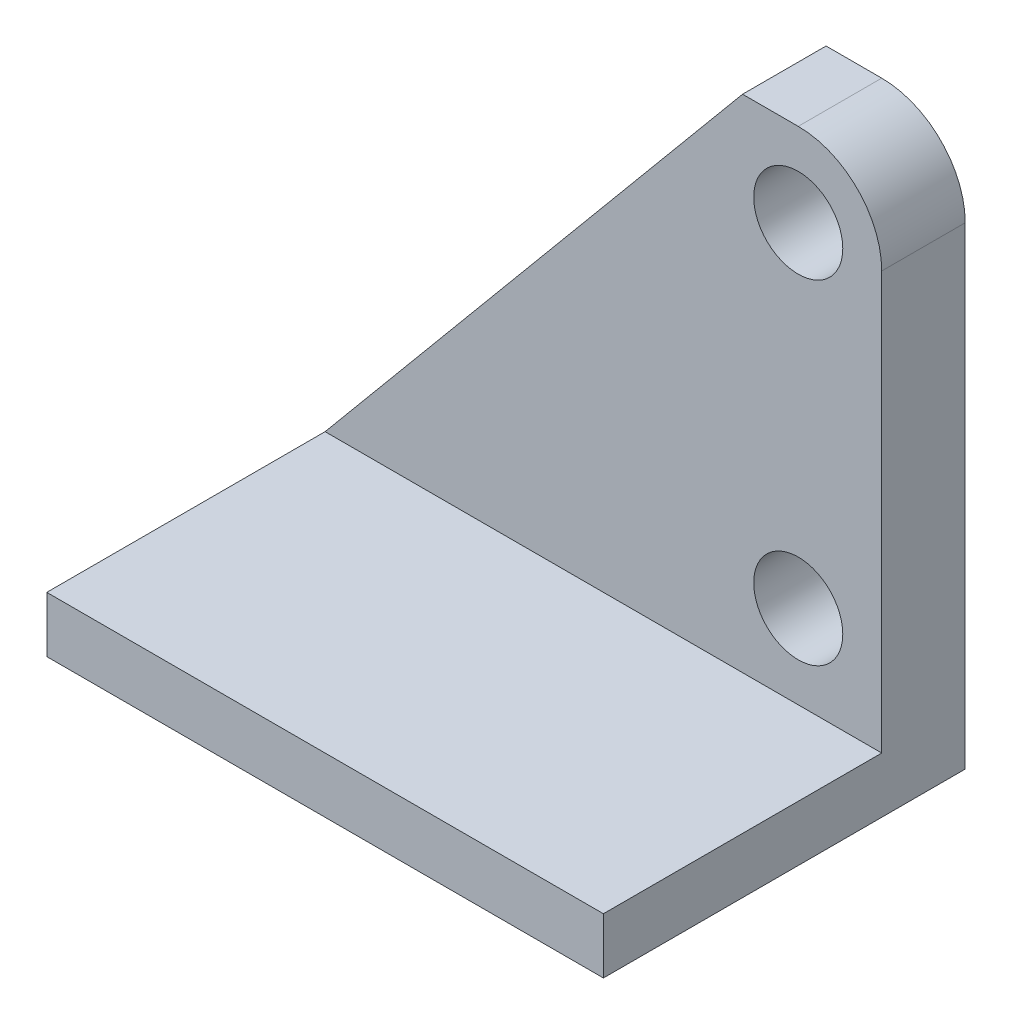
from build123d import *

# Parameters (mm, degrees)
SKETCH_1_R          = 1.6
EXTRUDE_1_DEPTH     = 3
SKETCH_2_W          = 20
SKETCH_2_H          = 2
EXTRUDE_2_DEPTH     = 10
CUT_EXTRUDE_1_DEPTH = 20


with BuildPart() as part:
    # 草图1 → 凸台-拉伸1 (new body)
    with BuildSketch(Plane.XY):
        with BuildLine():
            Line((0, 0), (20, 0))
            Line((20, 0), (20, 17))
            ThreePointArc((20, 17), (19.121320344, 19.121320344), (17, 20))
            Line((17, 20), (0, 20))
            Line((0, 20), (0, 0))
        make_face()
        with Locations((17, 17)):
            Circle(SKETCH_1_R, mode=Mode.SUBTRACT)
        with Locations((17, 5)):
            Circle(SKETCH_1_R, mode=Mode.SUBTRACT)
    extrude(amount=EXTRUDE_1_DEPTH)

    # 草图2 → 凸台-拉伸2 (add)
    with BuildSketch(Plane.XY.offset(3)):
        with Locations((10, 1)):
            Rectangle(SKETCH_2_W, SKETCH_2_H)
    extrude(amount=EXTRUDE_2_DEPTH)

    # 草图3 → 切除-拉伸1 (cut)
    with BuildSketch(Plane.XY.offset(3)):
        Polygon((0, 2), (15, 20), (0, 20), align=None)
    extrude(amount=-CUT_EXTRUDE_1_DEPTH, mode=Mode.SUBTRACT)


solid = part.part
